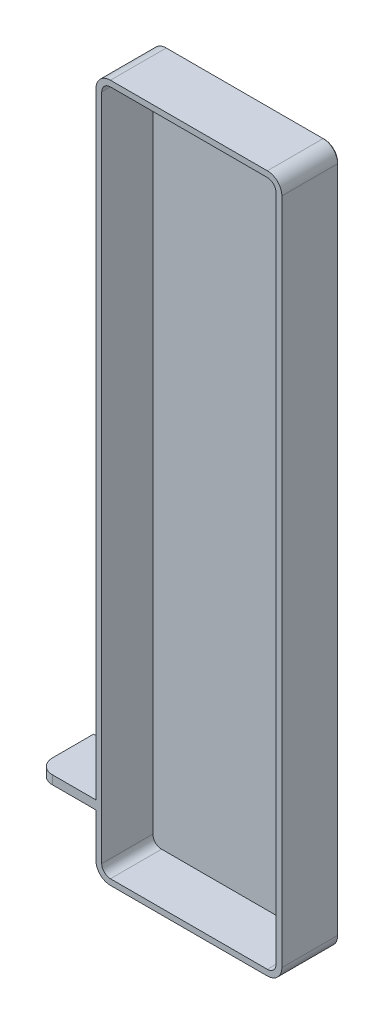
from build123d import *

# Parameters (mm, degrees)
SKETCH1_W           = 64
SKETCH1_H           = 240
BOSS_EXTRUDE1_DEPTH = 19.6
FILLET1_R           = 5
CUT_EXTRUDE1_DEPTH  = 17.6
SKETCH4_W           = 19.6
SKETCH4_H           = 3
BOSS_EXTRUDE2_DEPTH = 20
FILLET2_R           = 5
CHAMFER1_SIZE       = 0.4


with BuildPart() as part:
    # Sketch1 → Boss-Extrude1 (new body)
    with BuildSketch(Plane.XY):
        with Locations((-118.769864545, 120.565422017)):
            Rectangle(SKETCH1_W, SKETCH1_H)
    extrude(amount=BOSS_EXTRUDE1_DEPTH)

    # Fillet1
    fillet1_edges = [part.edges().sort_by_distance(p)[0] for p in [
        (-86.769864545, 0.565422017, 9.8),
        (-150.769864545, 0.565422017, 9.8),
        (-150.769864545, 240.565422017, 9.8),
        (-86.769864545, 240.565422017, 9.8),
    ]]
    fillet(fillet1_edges, radius=FILLET1_R)

    # Sketch3 → Cut-Extrude1 (cut)
    with BuildSketch(Plane.XY.offset(19.6)):
        with BuildLine():
            Line((-148.769864545, 235.565422017), (-148.769864545, 5.565422017))
            ThreePointArc((-148.769864545, 5.565422017), (-147.891184888, 3.444101674), (-145.769864545, 2.565422017))
            Line((-145.769864545, 2.565422017), (-91.769864545, 2.565422017))
            ThreePointArc((-91.769864545, 2.565422017), (-89.648544201, 3.444101674), (-88.769864545, 5.565422017))
            Line((-88.769864545, 5.565422017), (-88.769864545, 235.565422017))
            ThreePointArc((-88.769864545, 235.565422017), (-89.648544201, 237.686742361), (-91.769864545, 238.565422017))
            Line((-91.769864545, 238.565422017), (-145.769864545, 238.565422017))
            ThreePointArc((-145.769864545, 238.565422017), (-147.891184888, 237.686742361), (-148.769864545, 235.565422017))
        make_face()
    extrude(amount=-CUT_EXTRUDE1_DEPTH, mode=Mode.SUBTRACT)

    # Sketch4 → Boss-Extrude2 (add)
    with BuildSketch(Plane.ZY.offset(150.769864545)):
        with Locations((9.8, 22.065422017)):
            Rectangle(SKETCH4_W, SKETCH4_H)
    extrude(amount=BOSS_EXTRUDE2_DEPTH)

    # Fillet2
    fillet2_edges = [part.edges().sort_by_distance(p)[0] for p in [
        (-170.769864545, 22.065422017, 19.6),
    ]]
    fillet(fillet2_edges, radius=FILLET2_R)


with BuildPart() as part_1:
    # Body-Move/Copy1: moved
    add(part.part.moved(Location((0, -0.56542, 0))))


with BuildPart() as part_2:
    # Body-Move/Copy2: moved
    add(part_1.part.moved(Location((150.76986, 0, 0))))

    # Chamfer1
    chamfer1_edges = [part_2.edges().sort_by_distance(p)[0] for p in [
        (31.999995455, 2.017e-06, 0),
        (63.999995455, 120.000002017, 0),
        (-4.545e-06, 129.000002017, 0),
        (31.999995455, 240.000002017, 0),
        (1.464461549, 238.535535923, 0),
        (62.535529361, 238.535535923, 0),
        (62.535529361, 1.464468112, 0),
        (1.464461549, 1.464468112, 0),
        (-4.545e-06, 12.500002017, 0),
        (-10.000004545, 23.000002017, 0),
        (-10.000004545, 20.000002017, 0),
        (-20.000004545, 21.500002017, 0),
    ]]
    chamfer(chamfer1_edges, length=CHAMFER1_SIZE)


solid = part_2.part
